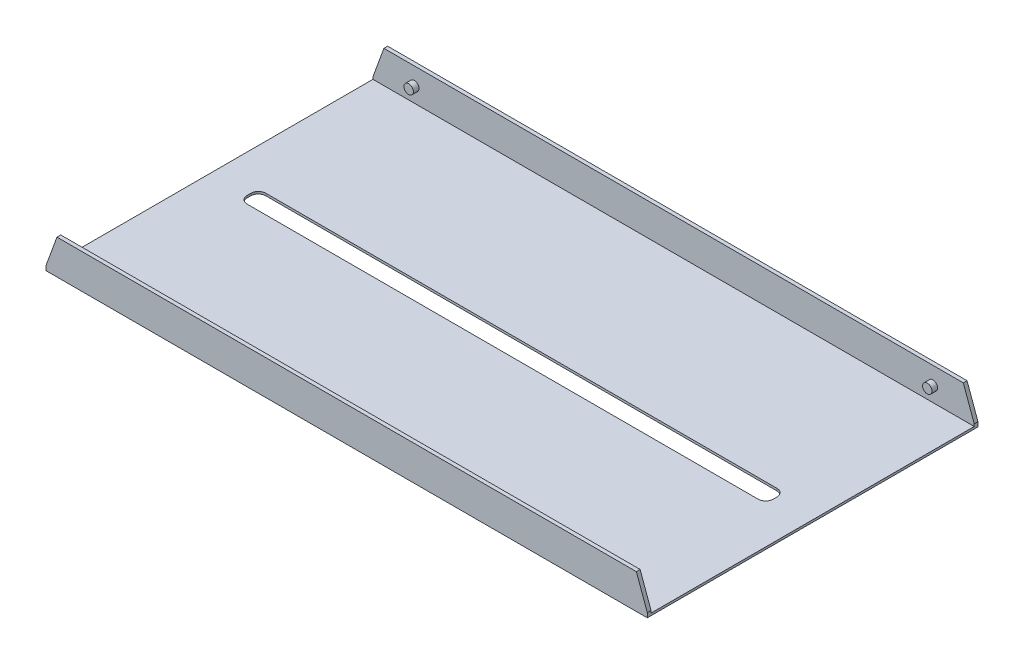
from build123d import *
from OCP.BRepFilletAPI import BRepFilletAPI_MakeChamfer

# Parameters (mm, degrees)
SKETCH1_W           = 160
SKETCH1_H           = 88
BOSS_EXTRUDE1_DEPTH = 0.6
SKETCH2_W           = 160
SKETCH2_H           = 1
BOSS_EXTRUDE2_DEPTH = 8.6
SKETCH3_R           = 1.25
BOSS_EXTRUDE3_DEPTH = 1.5
BOSS_EXTRUDE4_START = 1.5
SKETCH4_R           = 1.25
BOSS_EXTRUDE4_DEPTH = 1.5
CHAMFER1_SIZE       = 8
CHAMFER1_SIZE2      = 2.911761874
SKETCH5_W           = 140
SKETCH5_H           = 5
CUT_EXTRUDE1_DEPTH  = 1.5
FILLET1_R           = 2


with BuildPart() as part:
    # Sketch1 → Boss-Extrude1 (new body)
    with BuildSketch(Plane(origin=(0, 0, 0), x_dir=(1, 0, 0), z_dir=(0, 1, 0))):
        Rectangle(SKETCH1_W, SKETCH1_H)
    extrude(amount=BOSS_EXTRUDE1_DEPTH)

    # Sketch2 → Boss-Extrude2 (add)
    with BuildSketch(Plane(origin=(0, 0.6, 0), x_dir=(1, 0, 0), z_dir=(0, 1, 0))):
        with Locations((0, 43.5)):
            Rectangle(SKETCH2_W, SKETCH2_H)
        with Locations((0, -43.5)):
            Rectangle(SKETCH2_W, SKETCH2_H)
    extrude(amount=BOSS_EXTRUDE2_DEPTH)

    # Sketch3 → Boss-Extrude3 (add)
    with BuildSketch(Plane.XY.offset(-43)):
        with Locations(Location((-69, 4.6, 0), (0, 0, 180))):
            Circle(SKETCH3_R)
        with Locations(Location((69, 4.6, 0), (0, 0, 180))):
            Circle(SKETCH3_R)
    extrude(amount=BOSS_EXTRUDE3_DEPTH)

    # Sketch4 → Boss-Extrude4 (add)
    with BuildSketch(Plane(origin=(0, 0, 43), x_dir=(-1, 0, 0), z_dir=(0, 0, -1)).offset(BOSS_EXTRUDE4_START)):
        with Locations((-69, 4.6)):
            Circle(SKETCH4_R)
        with Locations((69, 4.6)):
            Circle(SKETCH4_R)
    extrude(amount=-BOSS_EXTRUDE4_DEPTH)

    # Chamfer1: one chamfer whose edges measure the first distance from different faces: ONE call of the kernel's chamfer builder (chamfer() names one face for all edges)
    chamfer1_edges_1 = [part.edges().sort_by_distance(p)[0] for p in [
        (-80, 9.2, -43.5),
        (-80, 9.2, 43.5),
    ]]
    chamfer1_side_1 = [part.faces().sort_by_distance(p)[0] for p in [
        (-80, 4.6, -43.115203978),
    ]]
    chamfer1_edges_2 = [part.edges().sort_by_distance(p)[0] for p in [
        (80, 9.2, -43.5),
        (80, 9.2, 43.5),
    ]]
    chamfer1_side_2 = [part.faces().sort_by_distance(p)[0] for p in [
        (80, 4.6, 43.115203978),
    ]]
    chamfer1 = BRepFilletAPI_MakeChamfer(part.part.solid().wrapped)
    for e in chamfer1_edges_1:
        chamfer1.Add(CHAMFER1_SIZE, CHAMFER1_SIZE2, e.wrapped, chamfer1_side_1[0].wrapped)  # the first distance lies on this face
    for e in chamfer1_edges_2:
        chamfer1.Add(CHAMFER1_SIZE, CHAMFER1_SIZE2, e.wrapped, chamfer1_side_2[0].wrapped)  # the first distance lies on this face
    add(Compound.cast(chamfer1.Shape()), mode=Mode.REPLACE)

    # Sketch5 → Cut-Extrude1 (cut)
    with BuildSketch(Plane(origin=(0, 0.6, 0), x_dir=(1, 0, 0), z_dir=(0, 1, 0))):
        Rectangle(SKETCH5_W, SKETCH5_H)
    extrude(amount=-CUT_EXTRUDE1_DEPTH, mode=Mode.SUBTRACT)

    # Fillet1
    fillet1_edges = [part.edges().sort_by_distance(p)[0] for p in [
        (70, 0.3, -2.5),
        (70, 0.3, 2.5),
        (-70, 0.3, 2.5),
        (-70, 0.3, -2.5),
    ]]
    fillet(fillet1_edges, radius=FILLET1_R)


solid = part.part
